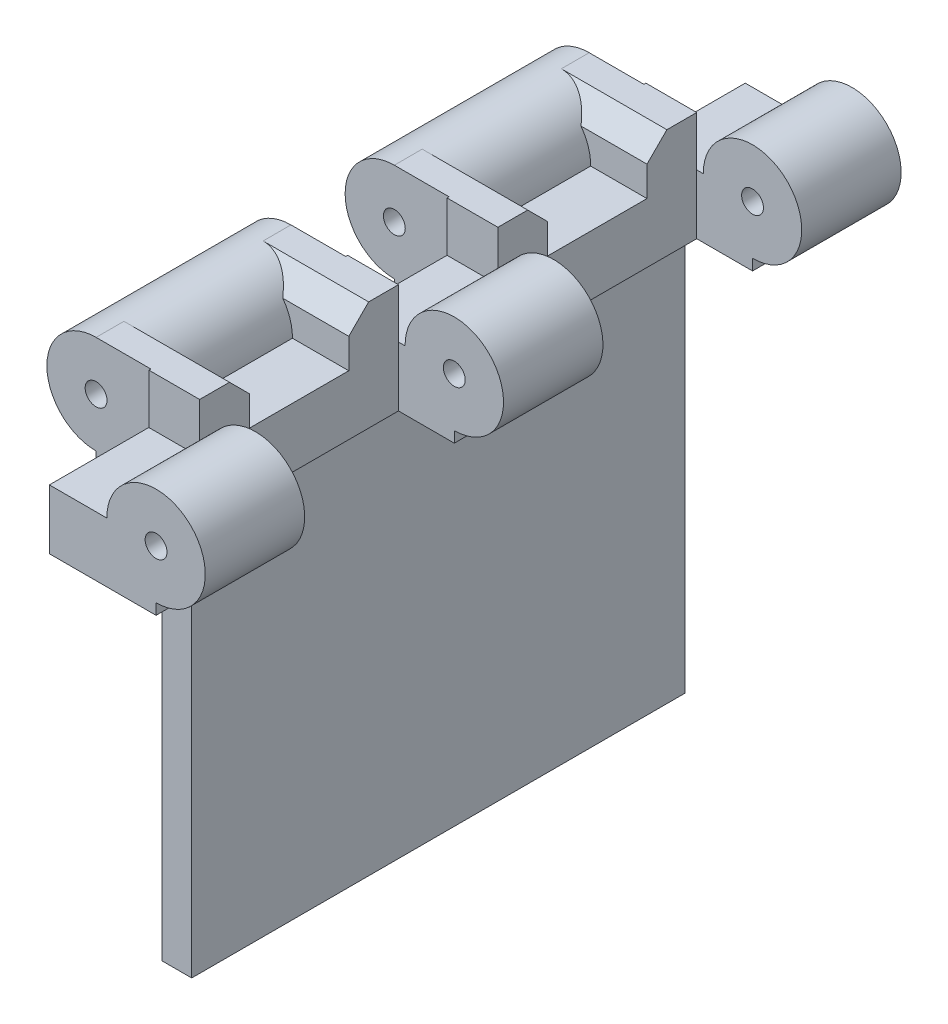
from build123d import *

# Parameters (mm, degrees)
SKETCH1_W             = 10.6165
SKETCH1_H             = 20
SKETCH1_W_2           = 10.732
SKETCH1_H_2           = 10
BOSS_EXTRUDE1_DEPTH   = 6
SKETCH2_W             = 10.6165
SKETCH2_H             = 5
BOSS_EXTRUDE2_DEPTH   = 5
CHAMFER1_SIZE         = 2
BOSS_EXTRUDE3_START   = -10
SKETCH3_R             = 4.95
BOSS_EXTRUDE3_DEPTH   = 20
BOSS_EXTRUDE4_START   = 10
SKETCH3_3_R           = 4.95
BOSS_EXTRUDE4_DEPTH   = 10
BOSS_EXTRUDE5_START   = -20
SKETCH3_4_R           = 4.95
BOSS_EXTRUDE5_DEPTH   = 10
BOSS_EXTRUDE6_START   = -40
SKETCH3_5_R           = 4.95
BOSS_EXTRUDE6_DEPTH   = 20
BOSS_EXTRUDE7_START   = -50
SKETCH3_6_R           = 4.95
BOSS_EXTRUDE7_DEPTH   = 10
F_1_0MM_DOWEL_HOLE1_D = 2.2
CUT_EXTRUDE1_START    = -0.2
CUT_EXTRUDE1_DEPTH    = 0.2
CUT_EXTRUDE2_START    = -30.2
CUT_EXTRUDE2_DEPTH    = 10.4
CUT_EXTRUDE3_START    = -50
CUT_EXTRUDE3_DEPTH    = 0.2
SKETCH10_W            = 3
SKETCH10_H            = 49.6
BOSS_EXTRUDE8_DEPTH   = 40


with BuildPart() as part:
    # Sketch1 → Boss-Extrude1 (new body)
    with BuildSketch(Plane(origin=(0, 0, 0), x_dir=(1, 0, 0), z_dir=(0, 1, 0))):
        Polygon((16.2325, -10), (10.6165, -10), (5.5005, -10), (5.5005, -20), (16.2325, -20), align=None)
        Polygon((10.6165, 0), (0, 0), (0, -10), (5.5005, -10), (10.6165, -10), align=None)
        Polygon((0, 10), (0, 0), (10.6165, 0), (10.6165, 10), (5.5005, 10), align=None)
        Polygon((5.5005, 10), (10.6165, 10), (16.2325, 10), (16.2325, 20), (10.6165, 20), (5.5005, 20), align=None)
        with Locations((5.30825, 30)):
            Rectangle(SKETCH1_W, SKETCH1_H)
        with Locations((10.8665, 45)):
            Rectangle(SKETCH1_W_2, SKETCH1_H_2)
    extrude(amount=BOSS_EXTRUDE1_DEPTH)

    # Sketch2 → Boss-Extrude2 (add)
    with BuildSketch(Plane(origin=(0, 6, 0), x_dir=(1, 0, 0), z_dir=(0, 1, 0))):
        with Locations((5.30825, 7.5)):
            Rectangle(SKETCH2_W, SKETCH2_H)
        with Locations((5.30825, -7.5)):
            Rectangle(SKETCH2_W, SKETCH2_H)
        with Locations((5.30825, 37.5)):
            Rectangle(SKETCH2_W, SKETCH2_H)
        with Locations((5.30825, 22.5)):
            Rectangle(SKETCH2_W, SKETCH2_H)
    extrude(amount=BOSS_EXTRUDE2_DEPTH)

    # Chamfer1
    chamfer1_edges = [part.edges().sort_by_distance(p)[0] for p in [
        (5.30825, 11, -35),
        (5.30825, 11, -25),
        (5.30825, 11, -5),
        (5.30825, 11, 5),
    ]]
    chamfer(chamfer1_edges, length=CHAMFER1_SIZE)

    # Sketch3 → Boss-Extrude3 (add)
    with BuildSketch(Plane.XY.offset(BOSS_EXTRUDE3_START)):
        with Locations((0, 6.05)):
            Circle(SKETCH3_R)
    extrude(amount=BOSS_EXTRUDE3_DEPTH)

    # Sketch3<3> → Boss-Extrude4 (add)
    with BuildSketch(Plane.XY.offset(BOSS_EXTRUDE4_START)):
        with Locations((16.2325, 6.05)):
            Circle(SKETCH3_3_R)
    extrude(amount=BOSS_EXTRUDE4_DEPTH)

    # Sketch3<4> → Boss-Extrude5 (add)
    with BuildSketch(Plane.XY.offset(BOSS_EXTRUDE5_START)):
        with Locations((16.2325, 6.05)):
            Circle(SKETCH3_4_R)
    extrude(amount=BOSS_EXTRUDE5_DEPTH)

    # Sketch3<5> → Boss-Extrude6 (add)
    with BuildSketch(Plane.XY.offset(BOSS_EXTRUDE6_START)):
        with Locations((0, 6.05)):
            Circle(SKETCH3_5_R)
    extrude(amount=BOSS_EXTRUDE6_DEPTH)

    # Sketch3<6> → Boss-Extrude7 (add)
    with BuildSketch(Plane.XY.offset(BOSS_EXTRUDE7_START)):
        with Locations((16.2325, 6.05)):
            Circle(SKETCH3_6_R)
    extrude(amount=BOSS_EXTRUDE7_DEPTH)

    # Ø1.0mm Dowel Hole1 (through all)
    with Locations(Plane.XY.offset(20)):
        with Locations((0, 6.05), (16.2325, 6.05)):
            Hole(F_1_0MM_DOWEL_HOLE1_D / 2)

    # Sketch9 → Cut-Extrude1 (cut)
    with BuildSketch(Plane.XY.offset(10).offset(CUT_EXTRUDE1_START)):
        with BuildLine():
            Line((5.5005, 6), (5.5005, 11))
            Line((5.5005, 11), (0, 11))
            ThreePointArc((0, 11), (-4.95, 6.05), (0, 1.1))
            Line((0, 1.1), (0, 0))
            Line((0, 0), (5.5005, 0))
            Line((5.5005, 0), (5.5005, 6))
        make_face()
    extrude(amount=CUT_EXTRUDE1_DEPTH, mode=Mode.SUBTRACT)

    # Sketch9<2> → Cut-Extrude2 (cut)
    with BuildSketch(Plane.XY.offset(10).offset(CUT_EXTRUDE2_START)):
        with BuildLine():
            Line((5.5005, 0), (5.5005, 6))
            Line((5.5005, 6), (5.5005, 11))
            Line((5.5005, 11), (0, 11))
            ThreePointArc((0, 11), (-4.95, 6.05), (0, 1.1))
            Line((0, 1.1), (0, 0))
            Line((0, 0), (5.5005, 0))
        make_face()
    extrude(amount=CUT_EXTRUDE2_DEPTH, mode=Mode.SUBTRACT)

    # Sketch9<4> → Cut-Extrude3 (cut)
    with BuildSketch(Plane.XY.offset(10).offset(CUT_EXTRUDE3_START)):
        with BuildLine():
            Line((5.5005, 0), (5.5005, 6))
            Line((5.5005, 6), (5.5005, 11))
            Line((5.5005, 11), (0, 11))
            ThreePointArc((0, 11), (-4.95, 6.05), (0, 1.1))
            Line((0, 1.1), (0, 0))
            Line((0, 0), (5.5005, 0))
        make_face()
    extrude(amount=CUT_EXTRUDE3_DEPTH, mode=Mode.SUBTRACT)

    # Sketch10 → Boss-Extrude8 (add)
    with BuildSketch(Plane.XZ):
        with Locations((8.11625, -15)):
            Rectangle(SKETCH10_W, SKETCH10_H)
    extrude(amount=BOSS_EXTRUDE8_DEPTH)


solid = part.part
